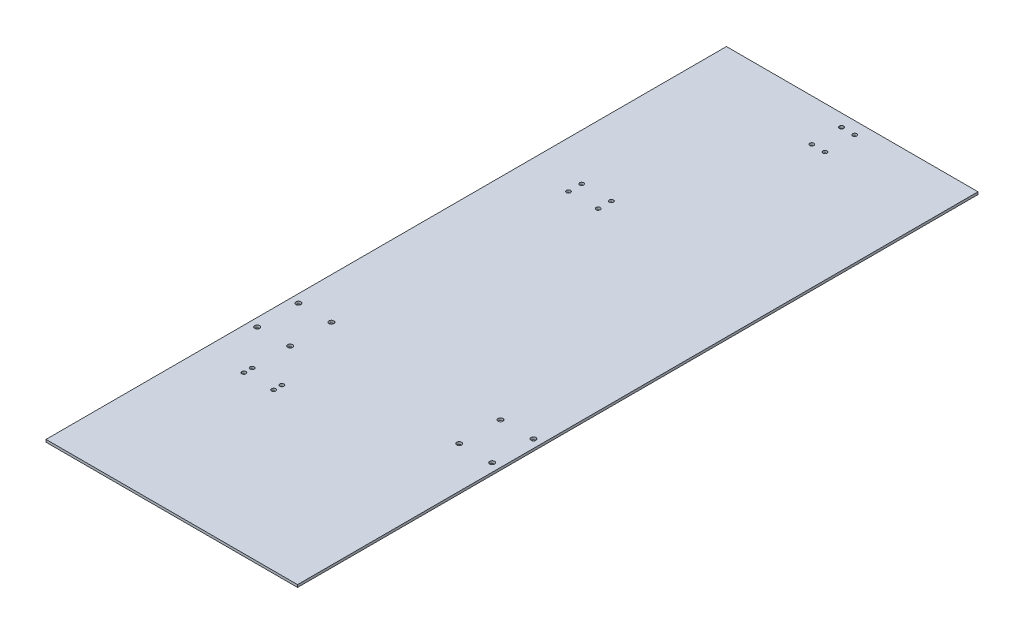
from build123d import *

# Parameters (mm, degrees)
BOSS_EXTRUDE1_DEPTH = 3
SKETCH2_R           = 2.5
CUT_EXTRUDE3_DEPTH  = 20
SKETCH3_W           = 289
SKETCH3_H           = 3
BOSS_EXTRUDE2_DEPTH = 600
SKETCH4_R           = 2.5
CUT_EXTRUDE4_DEPTH  = 10
SKETCH5_W           = 289
SKETCH5_H           = 75
CUT_EXTRUDE5_DEPTH  = 10
SKETCH6_R           = 2.5
CUT_EXTRUDE6_DEPTH  = 5
SKETCH7_W           = 8
SKETCH7_H           = 825
BOSS_EXTRUDE3_DEPTH = 3
SKETCH8_R           = 3
CUT_EXTRUDE7_DEPTH  = 699.337311047


with BuildPart() as part:
    # Sketch1 → Boss-Extrude1 (new body)
    with BuildSketch(Plane(origin=(0, 0, 0), x_dir=(1, 0, 0), z_dir=(0, 1, 0))):
        Polygon((-118, 150), (-171, 150), (-171, -150), (-118, -150), (118, -150), (118, 150), align=None)
    extrude(amount=BOSS_EXTRUDE1_DEPTH)

    # Sketch2 → Cut-Extrude3 (cut)
    with BuildSketch(Plane(origin=(0, 3, 0), x_dir=(1, 0, 0), z_dir=(0, 1, 0))):
        with Locations(Location((-129, 50, 0), (0, 0, 270))):
            Circle(SKETCH2_R)
        with Locations(Location((-129, 40, 0), (0, 0, 270))):
            Circle(SKETCH2_R)
        with Locations(Location((-93, 40, 0), (0, 0, 270))):
            Circle(SKETCH2_R)
        with Locations(Location((-93, 50, 0), (0, 0, 270))):
            Circle(SKETCH2_R)
    extrude(amount=-CUT_EXTRUDE3_DEPTH, mode=Mode.SUBTRACT)

    # Sketch3 → Boss-Extrude2 (add)
    with BuildSketch(Plane(origin=(0, 0, -150), x_dir=(-1, 0, 0), z_dir=(0, 0, -1))):
        with Locations((26.5, 1.5)):
            Rectangle(SKETCH3_W, SKETCH3_H)
    extrude(amount=BOSS_EXTRUDE2_DEPTH)

    # Sketch4 → Cut-Extrude4 (cut)
    with BuildSketch(Plane(origin=(0, 3, 0), x_dir=(1, 0, 0), z_dir=(0, 1, 0))):
        with Locations(Location((-8.5, 660, 0), (0, 0, 270))):
            Circle(SKETCH4_R)
        with Locations(Location((-8.5, 624, 0), (0, 0, 270))):
            Circle(SKETCH4_R)
        with Locations(Location((-24.5, 624, 0), (0, 0, 270))):
            Circle(SKETCH4_R)
        with Locations(Location((-24.5, 660, 0), (0, 0, 270))):
            Circle(SKETCH4_R)
    extrude(amount=-CUT_EXTRUDE4_DEPTH, mode=Mode.SUBTRACT)

    # Sketch5 → Cut-Extrude5 (cut)
    with BuildSketch(Plane(origin=(0, 3, 0), x_dir=(1, 0, 0), z_dir=(0, 1, 0))):
        with Locations((-26.5, 712.5)):
            Rectangle(SKETCH5_W, SKETCH5_H)
    extrude(amount=-CUT_EXTRUDE5_DEPTH, mode=Mode.SUBTRACT)

    # Sketch6 → Cut-Extrude6 (cut)
    with BuildSketch(Plane(origin=(0, 3, 0), x_dir=(1, 0, 0), z_dir=(0, 1, 0))):
        with Locations(Location((-86.5, 443, 0), (0, 0, 270))):
            Circle(SKETCH6_R)
        with Locations(Location((-86.5, 427, 0), (0, 0, 270))):
            Circle(SKETCH6_R)
        with Locations(Location((-122.5, 427, 0), (0, 0, 270))):
            Circle(SKETCH6_R)
        with Locations(Location((-122.5, 443, 0), (0, 0, 270))):
            Circle(SKETCH6_R)
    extrude(amount=-CUT_EXTRUDE6_DEPTH, mode=Mode.SUBTRACT)

    # Sketch7 → Boss-Extrude3 (add, through all)
    with BuildSketch(Plane(origin=(0, 3, 0), x_dir=(1, 0, 0), z_dir=(0, 1, 0))):
        with Locations((-175, 262.5)):
            Rectangle(SKETCH7_W, SKETCH7_H)
        with Locations((122, 262.5)):
            Rectangle(SKETCH7_W, SKETCH7_H)
    extrude(amount=-BOSS_EXTRUDE3_DEPTH)

    # Sketch8 → Cut-Extrude7 (cut, through all)
    with BuildSketch(Plane(origin=(0, 3, 0), x_dir=(1, 0, 0), z_dir=(0, 1, 0))):
        with Locations(Location((-169, 96, 0), (0, 0, 270))):
            Circle(SKETCH8_R)
        with Locations(Location((-169, 146, 0), (0, 0, 270))):
            Circle(SKETCH8_R)
        with Locations(Location((-129, 96, 0), (0, 0, 90))):
            Circle(SKETCH8_R)
        with Locations(Location((-129, 146, 0), (0, 0, 90))):
            Circle(SKETCH8_R)
        with Locations(Location((116, 96, 0), (0, 0, 90))):
            Circle(SKETCH8_R)
        with Locations(Location((76, 96, 0), (0, 0, 270))):
            Circle(SKETCH8_R)
        with Locations(Location((76, 146, 0), (0, 0, 270))):
            Circle(SKETCH8_R)
        with Locations(Location((116, 146, 0), (0, 0, 90))):
            Circle(SKETCH8_R)
    extrude(amount=-CUT_EXTRUDE7_DEPTH, mode=Mode.SUBTRACT)


solid = part.part
